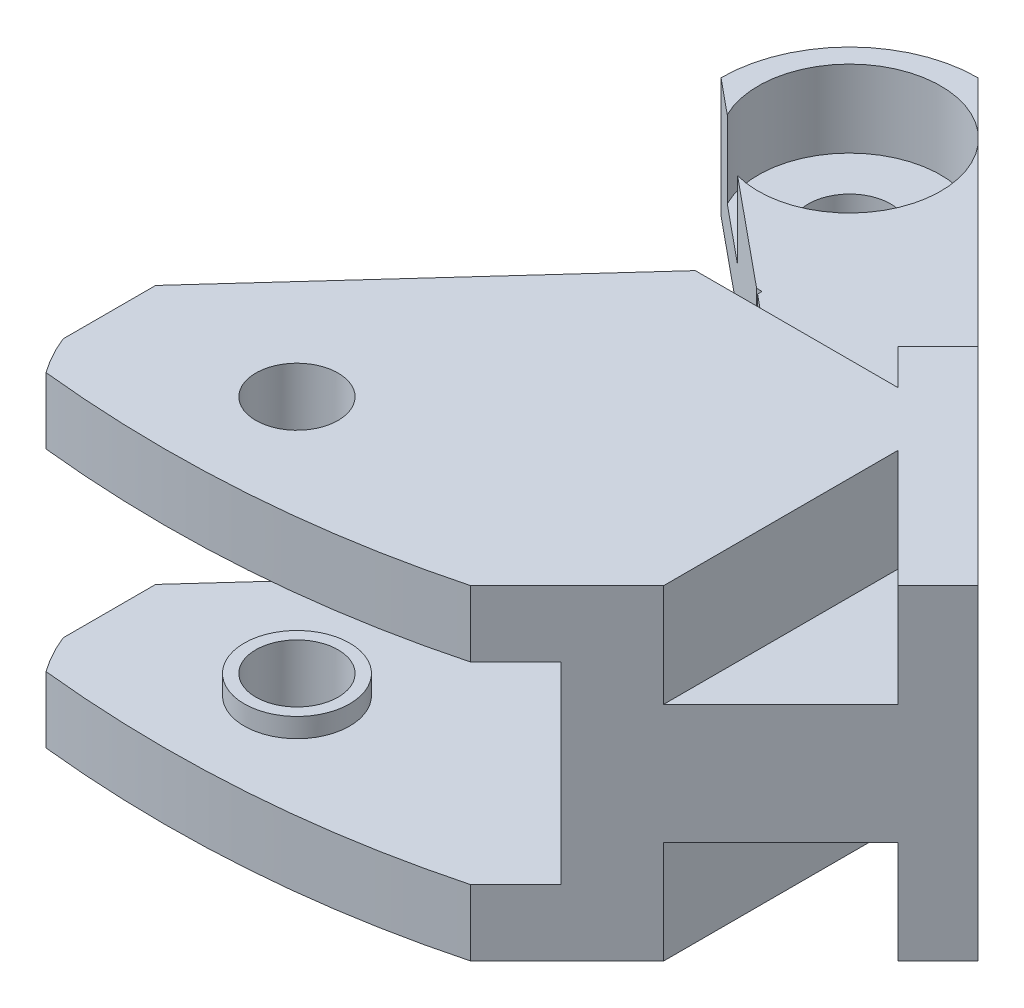
from build123d import *

# Parameters (mm, degrees)
SKETCH_1_R           = 1.6
EXTRUDE_1_DEPTH      = 4.65
SKETCH_7_W           = 9
SKETCH_7_H           = 19
EXTRUDE_4_DEPTH      = 4
SKETCH_8_W           = 9
SKETCH_8_H           = 19
EXTRUDE_5_DEPTH      = 4
SKETCH_9_W           = 16
SKETCH_9_H           = 7.5
CUT_EXTRUDE_3_DEPTH  = 9
SKETCH_11_R          = 1.6
CUT_EXTRUDE_5_DEPTH  = 26.4
EXTRUDE_6_DEPTH      = 9
SKETCH_13_W          = 19
SKETCH_13_H          = 12.65
EXTRUDE_7_DEPTH      = 2
SKETCH_15_W          = 7.596607022
SKETCH_15_H          = 7.5
CUT_EXTRUDE_6_DEPTH  = 8
CUT_EXTRUDE_7_DEPTH  = 8
EXTRUDE_8_DEPTH      = 4.65
CUT_EXTRUDE_9_DEPTH  = 4.65
SKETCH_20_W          = 5.380169682
SKETCH_20_H          = 3
CUT_EXTRUDE_10_DEPTH = 7.5
CUT_EXTRUDE_11_DEPTH = 4.65
CUT_EXTRUDE_13_DEPTH = 13
CUT_EXTRUDE_15_DEPTH = 13
SKETCH_26_W          = 18.396488504
SKETCH_26_H          = 12.65
EXTRUDE_9_DEPTH      = 2.2
SKETCH_28_W          = 2.5
SKETCH_28_H          = 12.65
CUT_EXTRUDE_17_DEPTH = 18
CUT_EXTRUDE_18_DEPTH = 14
SKETCH_31_W          = 5
SKETCH_31_H          = 12.65
CUT_EXTRUDE_19_DEPTH = 20
SKETCH_32_R          = 3.55
CUT_EXTRUDE_20_DEPTH = 3
EXTRUDE_START        = 0.75
SKETCH_33_R          = 2.05
SKETCH_33_R_2        = 1.6
EXTRUDE_10_DEPTH     = 0.75
SKETCH_34_R          = 2.05
SKETCH_34_R_2        = 1.6
EXTRUDE_11_DEPTH     = 0.75


with BuildPart() as part:
    # 草图1 → 凸台-拉伸1 (new body)
    with BuildSketch(Plane(origin=(0, 0, 0), x_dir=(1, 0, 0), z_dir=(0, 1, 0))):
        with BuildLine():
            Line((5, 0), (20, 0))
            Line((20, 0), (20, -16))
            Line((20, -16), (9, -16))
            Line((9, -16), (9, -35))
            Line((9, -35), (0, -35))
            Line((0, -35), (0, -27))
            Line((0, -27), (0, -5))
            ThreePointArc((0, -5), (1.464466094, -1.464466094), (5, 0))
        make_face()
        with Locations(Location((4.55, -4.55, 0), (0, 0, 270))):
            Circle(SKETCH_1_R, mode=Mode.SUBTRACT)
    extrude(amount=EXTRUDE_1_DEPTH)

    # 草图7 → 凸台-拉伸4 (add)
    with BuildSketch(Plane(origin=(0, 4.65, 0), x_dir=(1, 0, 0), z_dir=(0, 1, 0))):
        with Locations((4.5, -25.5)):
            Rectangle(SKETCH_7_W, SKETCH_7_H)
    extrude(amount=EXTRUDE_4_DEPTH)

    # 草图8 → 凸台-拉伸5 (add)
    with BuildSketch(Plane.XZ):
        with Locations((4.5, 25.5)):
            Rectangle(SKETCH_8_W, SKETCH_8_H)
    extrude(amount=EXTRUDE_5_DEPTH)

    # 草图9 → 切除-拉伸3 (cut)
    with BuildSketch(Plane.ZY):
        with Locations((27, 2.325)):
            Rectangle(SKETCH_9_W, SKETCH_9_H)
    extrude(amount=-CUT_EXTRUDE_3_DEPTH, mode=Mode.SUBTRACT)

    # 草图11 → 切除-拉伸5 (cut)
    with BuildSketch(Plane(origin=(0, 8.65, 0), x_dir=(1, 0, 0), z_dir=(0, 1, 0))):
        with Locations(Location((6.5, -28, 0), (0, 0, 270))):
            Circle(SKETCH_11_R)
    extrude(amount=-CUT_EXTRUDE_5_DEPTH, mode=Mode.SUBTRACT)

    # 草图12 → 凸台-拉伸6 (add)
    with BuildSketch(Plane(origin=(9, 0, 0), x_dir=(0, 0, -1), z_dir=(1, 0, 0))):
        Polygon((-35, 8.65), (-35, 6.075), (-19, 6.075), (-19, -1.425), (-35, -1.425), (-35, -4), (-16, -4), (-16, 8.65), align=None)
    extrude(amount=EXTRUDE_6_DEPTH)

    # 草图13 → 凸台-拉伸7 (add)
    with BuildSketch(Plane(origin=(18, 0, 0), x_dir=(0, 0, -1), z_dir=(1, 0, 0))):
        with Locations((-25.5, 2.325)):
            Rectangle(SKETCH_13_W, SKETCH_13_H)
    extrude(amount=EXTRUDE_7_DEPTH)

    # 草图15 → 切除-拉伸6 (cut)
    with BuildSketch(Plane.ZY):
        with Locations((15.201696489, 2.325)):
            Rectangle(SKETCH_15_W, SKETCH_15_H)
    extrude(amount=-CUT_EXTRUDE_6_DEPTH, mode=Mode.SUBTRACT)

    # 草图16 → 切除-拉伸7 (cut)
    with BuildSketch(Plane(origin=(0, 4.65, 0), x_dir=(1, 0, 0), z_dir=(0, 1, 0))):
        Polygon((0, -5), (5.890898071, -11.403392978), (0, -11.403392978), align=None)
    extrude(amount=-CUT_EXTRUDE_7_DEPTH, mode=Mode.SUBTRACT)

    # 草图17 → 凸台-拉伸8 (add)
    with BuildSketch(Plane.XZ):
        with BuildLine():
            Line((20, 35), (20, 15))
            Line((20, 15), (31.064630957, 26.064630957))
            ThreePointArc((31.064630957, 26.064630957), (26.002686727, 31.114774273), (20, 35))
        make_face()
    extrude(amount=-EXTRUDE_8_DEPTH)

    # 草图19 → 切除-拉伸9 (cut)
    with BuildSketch(Plane(origin=(0, 4.65, 0), x_dir=(1, 0, 0), z_dir=(0, 1, 0))):
        Polygon((20, -15), (5, 0), (20, 0), align=None)
    extrude(amount=-CUT_EXTRUDE_9_DEPTH, mode=Mode.SUBTRACT)

    # 草图20 → 切除-拉伸10 (cut)
    with BuildSketch(Plane(origin=(0, -1.425, 0), x_dir=(1, 0, 0), z_dir=(0, 1, 0))):
        with Locations((10.690084841, -17.5)):
            Rectangle(SKETCH_20_W, SKETCH_20_H)
    extrude(amount=CUT_EXTRUDE_10_DEPTH, mode=Mode.SUBTRACT)

    # 草图21 → 切除-拉伸11 (cut)
    with BuildSketch(Plane.XZ):
        Polygon((13.380169682, 16), (0, 5), (8, 16), align=None)
    extrude(amount=-CUT_EXTRUDE_11_DEPTH, mode=Mode.SUBTRACT)

    # 草图22 → 切除-拉伸13 (cut)
    with BuildSketch(Plane(origin=(0, 8.65, 0), x_dir=(1, 0, 0), z_dir=(0, 1, 0))):
        Polygon((0, -16), (10, -16), (0, -27), align=None)
    extrude(amount=-CUT_EXTRUDE_13_DEPTH, mode=Mode.SUBTRACT)

    # 草图23 → 切除-拉伸15 (cut)
    with BuildSketch(Plane(origin=(0, 8.65, 0), x_dir=(1, 0, 0), z_dir=(0, 1, 0))):
        with BuildLine():
            Line((6.5, -35), (0, -35))
            Line((0, -35), (0, -30.598076211))
            ThreePointArc((0, -30.598076211), (2.574858823, -33.79596987), (6.5, -35))
        make_face()
    extrude(amount=-CUT_EXTRUDE_15_DEPTH, mode=Mode.SUBTRACT)

    # 草图26 → 凸台-拉伸9 (add)
    with BuildSketch(Plane(origin=(2.5, 0, -2.5), x_dir=(-0.7071067811865509, 0, -0.7071067811865442), z_dir=(0.7071067811865442, 0, -0.7071067811865509))):
        with Locations((-31.198244252, 2.325)):
            Rectangle(SKETCH_26_W, SKETCH_26_H)
    extrude(amount=-EXTRUDE_9_DEPTH)

    # 草图28 → 切除-拉伸17 (cut)
    with BuildSketch(Plane(origin=(2.5, 0, -2.5), x_dir=(-0.7071067811865509, 0, -0.7071067811865442), z_dir=(0.7071067811865442, 0, -0.7071067811865509))):
        with Locations((-39.646488504, 2.325)):
            Rectangle(SKETCH_28_W, SKETCH_28_H)
    extrude(amount=-CUT_EXTRUDE_17_DEPTH, mode=Mode.SUBTRACT)

    # 草图29 → 切除-拉伸18 (cut)
    with BuildSketch(Plane.XZ.offset(4)):
        with BuildLine():
            Line((29.650417395, 24.650417395), (19.300834789, 35))
            Line((19.300834789, 35), (1.773611639, 35))
            Line((1.773611639, 35), (0.803925841, 32.06875155))
            add(Edge.make_bspline(
                [(29.650417395, 24.650417395), (16.711479186, 33.756910479), (0.803925841, 32.06875155)],
                knots=[0, 0, 0, 1, 1, 1], degree=2))
        make_face()
    extrude(amount=-CUT_EXTRUDE_18_DEPTH, mode=Mode.SUBTRACT)

    # 草图31 → 切除-拉伸19 (cut)
    with BuildSketch(Plane(origin=(2.5, 0, -2.5), x_dir=(-0.7071067811865509, 0, -0.7071067811865442), z_dir=(0.7071067811865442, 0, -0.7071067811865509))):
        with Locations((-35.896488504, 2.325)):
            Rectangle(SKETCH_31_W, SKETCH_31_H)
    extrude(amount=-CUT_EXTRUDE_19_DEPTH, mode=Mode.SUBTRACT)

    # 草图32 → 切除-拉伸20 (cut)
    with BuildSketch(Plane(origin=(0, 4.65, 0), x_dir=(1, 0, 0), z_dir=(0, 1, 0))):
        with Locations((4.55, -4.55)):
            Circle(SKETCH_32_R)
    extrude(amount=-CUT_EXTRUDE_20_DEPTH, mode=Mode.SUBTRACT)

    # 草图33 → 凸台-拉伸10 (add)
    with BuildSketch(Plane(origin=(0, -1.425, 0), x_dir=(1, 0, 0), z_dir=(0, 1, 0)).offset(EXTRUDE_START)):
        with Locations(Location((6.5, -28, 0), (0, 0, 90))):
            Circle(SKETCH_33_R)
        with Locations(Location((6.5, -28, 0), (0, 0, 270))):
            Circle(SKETCH_33_R_2, mode=Mode.SUBTRACT)
    extrude(amount=-EXTRUDE_10_DEPTH)

    # 草图34 → 凸台-拉伸11 (add)
    with BuildSketch(Plane.XZ.offset(-6.075)):
        with Locations(Location((6.5, 28, 0), (0, 0, 270))):
            Circle(SKETCH_34_R)
        with Locations(Location((6.5, 28, 0), (0, 0, 90))):
            Circle(SKETCH_34_R_2, mode=Mode.SUBTRACT)
    extrude(amount=EXTRUDE_11_DEPTH)


solid = part.part
